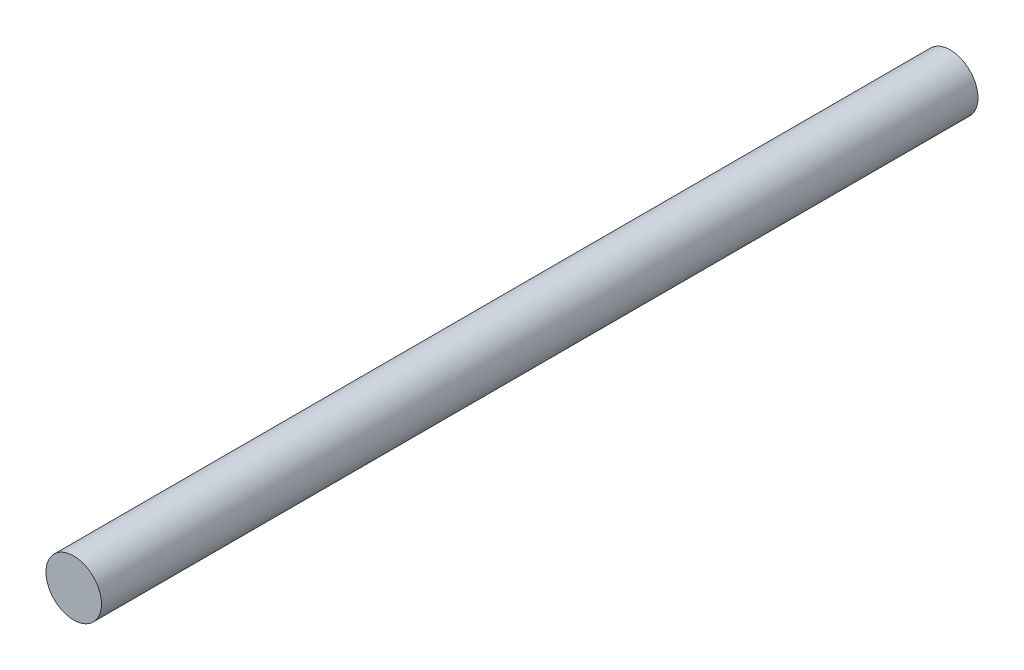
from build123d import *

# Parameters (mm, degrees)
SKETCH1_R           = 2.375
BOSS_EXTRUDE1_DEPTH = 75


with BuildPart() as part:
    # Sketch1 → Boss-Extrude1 (new body)
    with BuildSketch(Plane.XY):
        Circle(SKETCH1_R)
    extrude(amount=BOSS_EXTRUDE1_DEPTH)


solid = part.part
